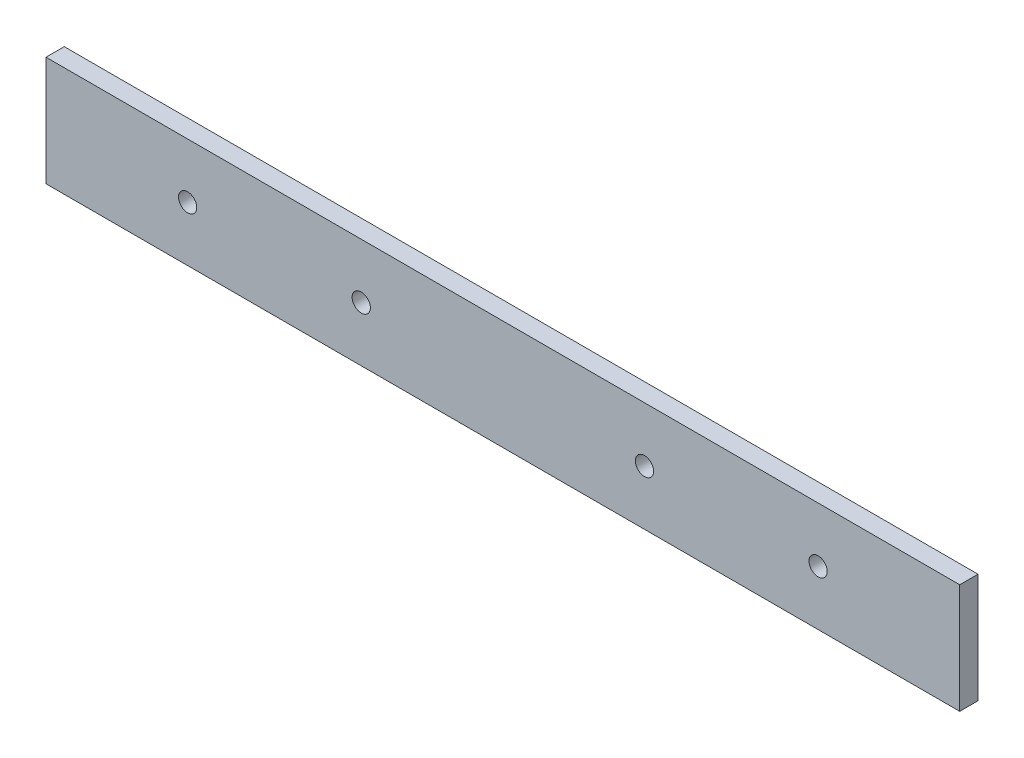
from build123d import *

# Parameters (mm, degrees)
SKETCH1_W           = 500
SKETCH1_H           = 60
SKETCH1_R           = 5
BOSS_EXTRUDE1_DEPTH = 5


with BuildPart() as part:
    # Sketch1 → Boss-Extrude1 (new, symmetric)
    with BuildSketch(Plane.XY):
        Rectangle(SKETCH1_W, SKETCH1_H)
        with Locations((172.5, 0)):
            Circle(SKETCH1_R, mode=Mode.SUBTRACT)
        with Locations((77.5, 0)):
            Circle(SKETCH1_R, mode=Mode.SUBTRACT)
        with Locations(Location((-172.5, 0, 0), (0, 0, 180))):
            Circle(SKETCH1_R, mode=Mode.SUBTRACT)
        with Locations(Location((-77.5, 0, 0), (0, 0, 180))):
            Circle(SKETCH1_R, mode=Mode.SUBTRACT)
    extrude(amount=BOSS_EXTRUDE1_DEPTH, both=True)


solid = part.part
